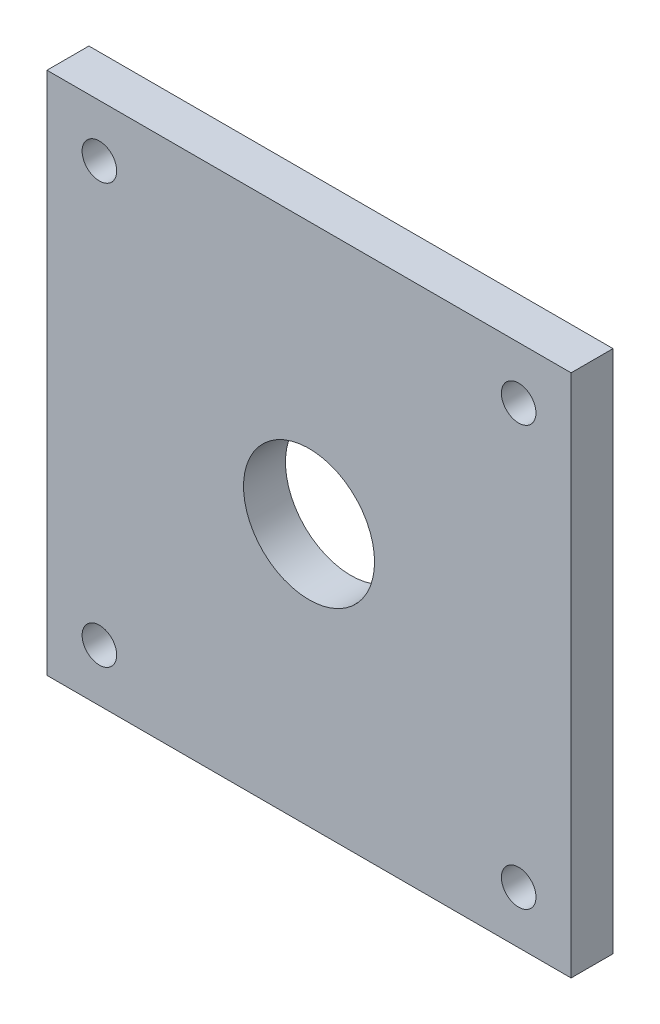
from build123d import *

# Parameters (mm, degrees)
SKETCH_1_W      = 50
SKETCH_1_H      = 50
SKETCH_1_R      = 1.65
SKETCH_1_R_2    = 6.25
EXTRUDE_1_DEPTH = 4


with BuildPart() as part:
    # 草图1 → 凸台-拉伸1 (new body)
    with BuildSketch(Plane.XY):
        Rectangle(SKETCH_1_W, SKETCH_1_H)
        with Locations((-20, -20)):
            Circle(SKETCH_1_R, mode=Mode.SUBTRACT)
        with Locations((-20, 20)):
            Circle(SKETCH_1_R, mode=Mode.SUBTRACT)
        with Locations((20, 20)):
            Circle(SKETCH_1_R, mode=Mode.SUBTRACT)
        with Locations((20, -20)):
            Circle(SKETCH_1_R, mode=Mode.SUBTRACT)
        Circle(SKETCH_1_R_2, mode=Mode.SUBTRACT)
    extrude(amount=EXTRUDE_1_DEPTH)


solid = part.part
